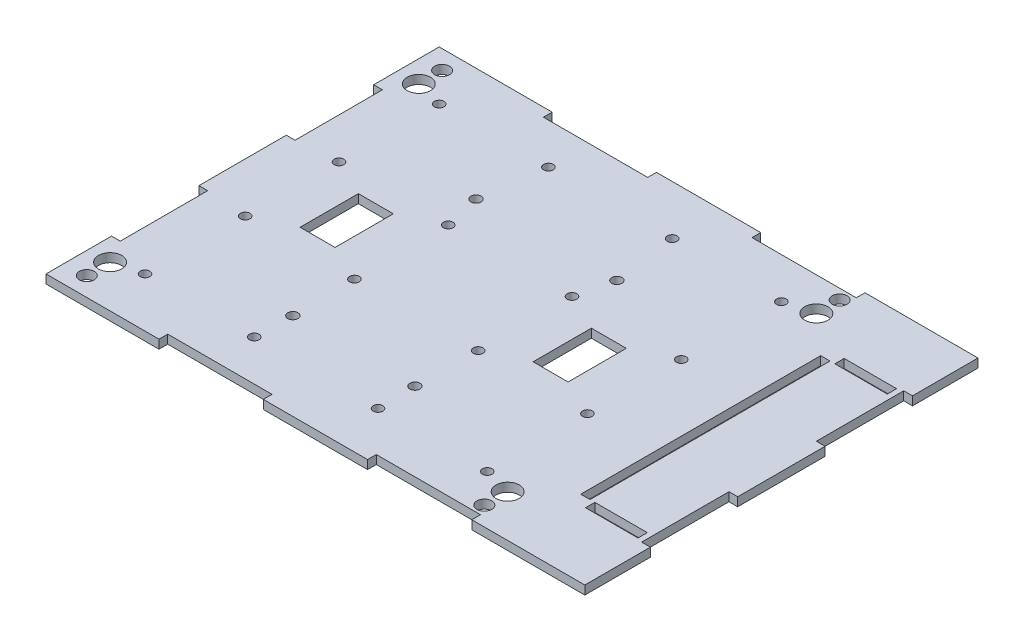
from build123d import *

# Parameters (mm, degrees)
SKETCH1_R           = 2.55
SKETCH1_R_2         = 4
SKETCH1_R_3         = 1.65
SKETCH1_R_4         = 1.75
SKETCH1_W           = 12
SKETCH1_H           = 20
SKETCH1_W_2         = 18
SKETCH1_H_2         = 3.2
SKETCH1_W_3         = 3.2
SKETCH1_H_3         = 82.4
BOSS_EXTRUDE1_DEPTH = 3


with BuildPart() as part:
    # Sketch1 → Boss-Extrude1 (new body)
    with BuildSketch(Plane(origin=(0, 0, 0), x_dir=(1, 0, 0), z_dir=(0, 1, 0))):
        Polygon((38.8, 0), (0, 0), (0, -22.5), (3, -22.5), (3, -52.5), (0, -52.5), (0, -82.5), (3, -82.5), (3, -112.5), (0, -112.5), (0, -135), (38.8, -135), (38.8, -132), (74.6, -132), (74.6, -135), (110.4, -135), (110.4, -132), (146.2, -132), (146.2, -135), (185, -135), (185, -112.5), (182, -112.5), (182, -82.5), (185, -82.5), (185, -52.5), (182, -52.5), (182, -22.5), (185, -22.5), (185, 0), (146.2, 0), (146.2, -3), (110.4, -3), (110.4, 0), (74.6, 0), (74.6, -3), (38.8, -3), align=None)
        with Locations((7.5, -128.5)):
            Circle(SKETCH1_R, mode=Mode.SUBTRACT)
        with Locations((7.5, -120.5)):
            Circle(SKETCH1_R_2, mode=Mode.SUBTRACT)
        with Locations((17, -118)):
            Circle(SKETCH1_R_3, mode=Mode.SUBTRACT)
        with Locations((54.5, -118)):
            Circle(SKETCH1_R_3, mode=Mode.SUBTRACT)
        with Locations((54.795, -105.03)):
            Circle(SKETCH1_R_4, mode=Mode.SUBTRACT)
        with Locations((17, -83.6)):
            Circle(SKETCH1_R_3, mode=Mode.SUBTRACT)
        with Locations((35.75, -67.5)):
            Rectangle(SKETCH1_W, SKETCH1_H, mode=Mode.SUBTRACT)
        with Locations((54.5, -83.6)):
            Circle(SKETCH1_R_3, mode=Mode.SUBTRACT)
        with Locations((97, -118)):
            Circle(SKETCH1_R_3, mode=Mode.SUBTRACT)
        with Locations((96.705, -105.03)):
            Circle(SKETCH1_R_4, mode=Mode.SUBTRACT)
        with Locations((134.501274191, -118)):
            Circle(SKETCH1_R_3, mode=Mode.SUBTRACT)
        with Locations((144.001274191, -128.5)):
            Circle(SKETCH1_R, mode=Mode.SUBTRACT)
        with Locations((144.001274191, -120.5)):
            Circle(SKETCH1_R_2, mode=Mode.SUBTRACT)
        with Locations((171.15, -110.3)):
            Rectangle(SKETCH1_W_2, SKETCH1_H_2, mode=Mode.SUBTRACT)
        with Locations((97, -83.6)):
            Circle(SKETCH1_R_3, mode=Mode.SUBTRACT)
        with Locations((134.5, -83.6)):
            Circle(SKETCH1_R_3, mode=Mode.SUBTRACT)
        with Locations((115.75, -67.5)):
            Rectangle(SKETCH1_W, SKETCH1_H, mode=Mode.SUBTRACT)
        with Locations((17, -51.4)):
            Circle(SKETCH1_R_3, mode=Mode.SUBTRACT)
        with Locations((54.5, -51.4)):
            Circle(SKETCH1_R_3, mode=Mode.SUBTRACT)
        with Locations((51.555, -38.93)):
            Circle(SKETCH1_R_4, mode=Mode.SUBTRACT)
        with Locations((17, -17)):
            Circle(SKETCH1_R_3, mode=Mode.SUBTRACT)
        with Locations((7.5, -14.5)):
            Circle(SKETCH1_R_2, mode=Mode.SUBTRACT)
        with Locations((7.5, -6.5)):
            Circle(SKETCH1_R, mode=Mode.SUBTRACT)
        with Locations((54.5, -17)):
            Circle(SKETCH1_R_3, mode=Mode.SUBTRACT)
        with Locations((97, -51.4)):
            Circle(SKETCH1_R_3, mode=Mode.SUBTRACT)
        with Locations((134.5, -51.4)):
            Circle(SKETCH1_R_3, mode=Mode.SUBTRACT)
        with Locations((99.945, -38.93)):
            Circle(SKETCH1_R_4, mode=Mode.SUBTRACT)
        with Locations((158.9, -67.5)):
            Rectangle(SKETCH1_W_3, SKETCH1_H_3, mode=Mode.SUBTRACT)
        with Locations((97, -17)):
            Circle(SKETCH1_R_3, mode=Mode.SUBTRACT)
        with Locations((134.5, -17)):
            Circle(SKETCH1_R_3, mode=Mode.SUBTRACT)
        with Locations((171.15, -24.7)):
            Rectangle(SKETCH1_W_2, SKETCH1_H_2, mode=Mode.SUBTRACT)
        with Locations((144, -14.5)):
            Circle(SKETCH1_R_2, mode=Mode.SUBTRACT)
        with Locations((144, -6.5)):
            Circle(SKETCH1_R, mode=Mode.SUBTRACT)
    extrude(amount=BOSS_EXTRUDE1_DEPTH)


solid = part.part
